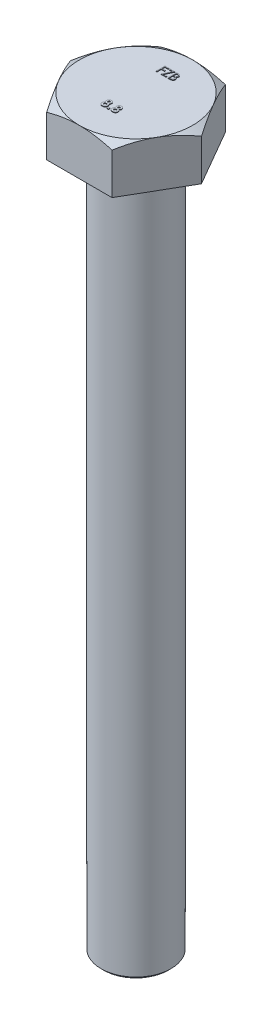
from build123d import *

# Parameters (mm, degrees)
BOSS_EXTRUDE1_DEPTH = 5.3
SKETCH4_R           = 4
BOSS_EXTRUDE3_DEPTH = 80
CHAMFER2_SIZE       = 0.3
BOSS_EXTRUDE5_DEPTH = 0.05


with BuildPart() as part:
    # Sketch2 → Boss-Extrude1 (new body)
    with BuildSketch(Plane(origin=(0, 0, 0), x_dir=(1, 0, 0), z_dir=(0, 1, 0))):
        Polygon((7.505553499, 0), (3.75277675, 6.5), (-3.75277675, 6.5), (-7.505553499, 0), (-3.75277675, -6.5), (3.75277675, -6.5), align=None)
    extrude(amount=-BOSS_EXTRUDE1_DEPTH)

    # Sketch4 → Boss-Extrude3 (add)
    with BuildSketch(Plane.XZ.offset(5.3)):
        Circle(SKETCH4_R)
    extrude(amount=BOSS_EXTRUDE3_DEPTH)

    # Chamfer2
    chamfer2_edges = [part.edges().sort_by_distance(p)[0] for p in [
        (-4, -85.3, 0),
    ]]
    chamfer(chamfer2_edges, length=CHAMFER2_SIZE)

    # Sketch6 → Cut-Revolve4 (revolve, cut)
    with BuildSketch(Plane.XY):
        Polygon((-6.5, 0), (-22.516660498, -9.24722325), (-22.516660498, 3.75277675), (-6.5, 3.75277675), align=None)
    revolve(axis=Axis((0, 0, 0), (0, 1, 0)), mode=Mode.SUBTRACT)

    # Sketch11 → Boss-Extrude5 (add)
    # profile 1 of 6: a face of its own
    with BuildSketch(Plane(origin=(0, 0, 0), x_dir=(1, 0, 0), z_dir=(0, 1, 0))):
        with BuildLine():
            add(Edge.make_bspline(
                [(-0.374198718, -2.711538462), (-0.363712458, -2.719031177), (-0.342955854, -2.733862332), (-0.315543972, -2.760432901), (-0.291932785, -2.790072678), (-0.272370236, -2.822599859), (-0.256697312, -2.857214919), (-0.245477876, -2.893547862), (-0.238351419, -2.931278225), (-0.237572997, -2.956966108), (-0.237179487, -2.969951923)],
                knots=[0, 0, 0, 0, 1.013736912, 2.006600758, 2.994453809, 3.989973287, 4.987781207, 5.978959008, 6.978317308, 8, 8, 8, 8], degree=3))
            add(Edge.make_bspline(
                [(-0.237179487, -2.969951923), (-0.237654227, -2.984013276), (-0.238595813, -3.011902163), (-0.246920691, -3.052801213), (-0.260285947, -3.092093405), (-0.278552179, -3.129345052), (-0.301454674, -3.163398515), (-0.328149662, -3.193545535), (-0.358670794, -3.21899877), (-0.387086833, -3.236268625), (-0.41154551, -3.247740664), (-0.431283448, -3.255082538), (-0.452125413, -3.261546031), (-0.47422013, -3.266709934), (-0.497563582, -3.270741207), (-0.522122455, -3.273403452), (-0.547912915, -3.275338742), (-0.565500918, -3.275538565), (-0.574519231, -3.275641026)],
                knots=[0, 0, 0, 0, 1.313679292, 2.605514271, 3.884962679, 5.186178731, 6.472827995, 7.711026938, 8.938935107, 10.174644318, 10.808706728, 11.462743532, 12.142127587, 12.847854939, 13.582806024, 14.355735269, 15.156897313, 16, 16, 16, 16], degree=3))
            add(Edge.make_bspline(
                [(-0.574519231, -3.275641026), (-0.584136366, -3.275510573), (-0.602916736, -3.275255826), (-0.630331892, -3.273715487), (-0.656192483, -3.270875699), (-0.680552756, -3.267137339), (-0.703389274, -3.262190405), (-0.724702714, -3.255917963), (-0.744544538, -3.248776091), (-0.768831974, -3.237901977), (-0.796588108, -3.220919719), (-0.82658747, -3.196049692), (-0.852919235, -3.166428713), (-0.87581221, -3.132888238), (-0.893857316, -3.095634609), (-0.907276195, -3.055837095), (-0.915223014, -3.013603543), (-0.916179722, -2.984675636), (-0.916666667, -2.969951923)],
                knots=[0, 0, 0, 0, 0.886964665, 1.7320671, 2.531131818, 3.285397207, 4.004107883, 4.684213108, 5.332925796, 5.947568694, 7.135706876, 8.320776993, 9.52873045, 10.778999824, 12.05415135, 13.333578234, 14.642845846, 16, 16, 16, 16], degree=3))
            add(Edge.make_bspline(
                [(-0.916666667, -2.969951923), (-0.916221681, -2.957107906), (-0.915347229, -2.931867856), (-0.909083416, -2.894883201), (-0.898342879, -2.859817372), (-0.883605191, -2.826426255), (-0.864601193, -2.794706134), (-0.841218505, -2.764890408), (-0.813753597, -2.736710096), (-0.792926445, -2.720068182), (-0.782251603, -2.711538462)],
                knots=[0, 0, 0, 0, 1.01821053, 2.000906977, 2.963938143, 3.919209931, 4.888045165, 5.887808425, 6.917407893, 8, 8, 8, 8], degree=3))
            add(Edge.make_bspline(
                [(-0.782251603, -2.711538462), (-0.788869438, -2.703905756), (-0.801897964, -2.688879258), (-0.818757004, -2.664695307), (-0.832960036, -2.639761628), (-0.845019086, -2.614280571), (-0.853933443, -2.587813416), (-0.860674752, -2.56077628), (-0.86448763, -2.532893718), (-0.865083594, -2.514100043), (-0.865384615, -2.504607372)],
                knots=[0, 0, 0, 0, 1.061529281, 2.089831458, 3.092927091, 4.075998741, 5.048384512, 6.024008542, 7.00192825, 8, 8, 8, 8], degree=3))
            add(Edge.make_bspline(
                [(-0.865384615, -2.504607372), (-0.864985507, -2.491757094), (-0.864198082, -2.466403991), (-0.857223904, -2.429331768), (-0.845645074, -2.394105767), (-0.829893061, -2.360829126), (-0.809890453, -2.330227071), (-0.786123025, -2.30278387), (-0.758256652, -2.279504754), (-0.727327611, -2.259530246), (-0.69318087, -2.243642707), (-0.656140411, -2.232525797), (-0.616653501, -2.225488207), (-0.589440302, -2.224741111), (-0.575520833, -2.224358974)],
                knots=[0, 0, 0, 0, 1.022455555, 2.017265428, 2.990720743, 3.968117071, 4.939886797, 5.893155559, 6.847550415, 7.820889576, 8.817530429, 9.83499769, 10.892607882, 12, 12, 12, 12], degree=3))
            add(Edge.make_bspline(
                [(-0.575520833, -2.224358974), (-0.561801841, -2.224741737), (-0.535052679, -2.225488044), (-0.496259699, -2.232479002), (-0.460019692, -2.243843543), (-0.426632334, -2.260066539), (-0.396023159, -2.280079546), (-0.368630396, -2.304169219), (-0.34493755, -2.332295938), (-0.324768908, -2.363689658), (-0.3086976, -2.397511843), (-0.296816138, -2.432981426), (-0.28994376, -2.469819612), (-0.288957588, -2.494831002), (-0.288461538, -2.507411859)],
                knots=[0, 0, 0, 0, 1.094655142, 2.134348324, 3.136019022, 4.118575226, 5.088726318, 6.048298823, 7.020513804, 8.015920439, 9.020015034, 10.003048569, 10.995523219, 12, 12, 12, 12], degree=3))
            add(Edge.make_bspline(
                [(-0.288461538, -2.507411859), (-0.288700497, -2.516303328), (-0.289169437, -2.533752172), (-0.292636679, -2.559459244), (-0.298475089, -2.584125214), (-0.306615154, -2.608346156), (-0.317932624, -2.632780291), (-0.333247791, -2.657895818), (-0.351876682, -2.684736295), (-0.36650688, -2.702302838), (-0.374198718, -2.711538462)],
                knots=[0, 0, 0, 0, 0.940746401, 1.846144481, 2.739104268, 3.619506754, 4.545839139, 5.581956076, 6.728711598, 8, 8, 8, 8], degree=3))
        make_face()
        with BuildLine():
            add(Edge.make_bspline(
                [(-0.579927885, -2.403846154), (-0.587317747, -2.404202414), (-0.601692661, -2.404895418), (-0.62220398, -2.411150545), (-0.640644326, -2.421381251), (-0.65659276, -2.435460716), (-0.669671307, -2.452544038), (-0.679283321, -2.472184807), (-0.684983359, -2.494140635), (-0.685586818, -2.509514522), (-0.685897436, -2.517427885)],
                knots=[0, 0, 0, 0, 1.018099191, 1.980427864, 2.929421084, 3.909248076, 4.895556904, 5.880788387, 6.909183412, 8, 8, 8, 8], degree=3))
            add(Edge.make_bspline(
                [(-0.685897436, -2.517427885), (-0.685513728, -2.525408829), (-0.684764503, -2.540992393), (-0.678872683, -2.563370063), (-0.668829915, -2.583650597), (-0.655041261, -2.601410399), (-0.638285814, -2.615916092), (-0.61952485, -2.626994733), (-0.598550305, -2.633319241), (-0.58397501, -2.634176867), (-0.576522436, -2.634615385)],
                knots=[0, 0, 0, 0, 1.07118507, 2.091592095, 3.082435519, 4.092579768, 5.090825648, 6.043203473, 6.999459622, 8, 8, 8, 8], degree=3))
            add(Edge.make_bspline(
                [(-0.576522436, -2.634615385), (-0.568928967, -2.634275609), (-0.554135464, -2.633613662), (-0.53310855, -2.62712505), (-0.514165987, -2.616747837), (-0.49794448, -2.602076754), (-0.484508089, -2.58431052), (-0.474722677, -2.563675567), (-0.469090546, -2.540559598), (-0.468338637, -2.524403658), (-0.467948718, -2.516025641)],
                knots=[0, 0, 0, 0, 1.008803858, 1.965339183, 2.900766489, 3.864508618, 4.855158575, 5.849593072, 6.884859315, 8, 8, 8, 8], degree=3))
            add(Edge.make_bspline(
                [(-0.467948718, -2.516025641), (-0.4683485, -2.508117509), (-0.469121666, -2.492823461), (-0.474665556, -2.470866209), (-0.484847187, -2.451531985), (-0.498224537, -2.434554747), (-0.514996149, -2.420863661), (-0.534466762, -2.410795154), (-0.556493002, -2.404955322), (-0.571947096, -2.404223883), (-0.579927885, -2.403846154)],
                knots=[0, 0, 0, 0, 1.065910571, 2.061433587, 3.023559535, 3.990682701, 4.956464619, 5.918590567, 6.925120432, 8, 8, 8, 8], degree=3))
        make_face(mode=Mode.SUBTRACT)
        with BuildLine():
            add(Edge.make_bspline(
                [(-0.57411859, -2.814102564), (-0.579734326, -2.814195822), (-0.59080287, -2.814379631), (-0.607074541, -2.816499233), (-0.622688881, -2.819657963), (-0.637626519, -2.824015342), (-0.65181199, -2.829955546), (-0.665365541, -2.837116572), (-0.678240362, -2.845570809), (-0.690245486, -2.855164769), (-0.701095312, -2.865695055), (-0.710875443, -2.876677802), (-0.71886932, -2.888396943), (-0.725526313, -2.900462931), (-0.730875245, -2.912971382), (-0.734411293, -2.926128285), (-0.736688013, -2.939758426), (-0.737014699, -2.949042725), (-0.737179487, -2.953725962)],
                knots=[0, 0, 0, 0, 1.129580664, 2.226389355, 3.296443603, 4.333934503, 5.352185725, 6.386189251, 7.41493955, 8.447544828, 9.47401038, 10.455044306, 11.4018853, 12.322125673, 13.225630306, 14.132028716, 15.057747923, 16, 16, 16, 16], degree=3))
            add(Edge.make_bspline(
                [(-0.737179487, -2.953725962), (-0.737100946, -2.958610114), (-0.73694517, -2.968297227), (-0.734592383, -2.982436351), (-0.731204786, -2.996072564), (-0.726446798, -3.009078225), (-0.720083893, -3.02144576), (-0.712486469, -3.03329541), (-0.703389606, -3.044544083), (-0.693039964, -3.055131466), (-0.681453585, -3.064683176), (-0.668966009, -3.073098399), (-0.655742166, -3.08051769), (-0.641385087, -3.085861357), (-0.626426471, -3.090752351), (-0.610465573, -3.093719599), (-0.593676721, -3.095902983), (-0.582206127, -3.096068792), (-0.576322115, -3.096153846)],
                knots=[0, 0, 0, 0, 0.973817353, 1.931446211, 2.852767904, 3.776304432, 4.688323523, 5.623710549, 6.581246645, 7.570897993, 8.57436511, 9.572506873, 10.574556662, 11.591826551, 12.624694332, 13.712108235, 14.826391851, 16, 16, 16, 16], degree=3))
            add(Edge.make_bspline(
                [(-0.576322115, -3.096153846), (-0.570374255, -3.096046034), (-0.558783758, -3.095835943), (-0.541840782, -3.093979132), (-0.525815734, -3.091032913), (-0.510727755, -3.086819133), (-0.496519789, -3.081421114), (-0.483382424, -3.074550504), (-0.471015712, -3.06676419), (-0.459817059, -3.057667448), (-0.449591863, -3.047753897), (-0.440781422, -3.036889488), (-0.433290001, -3.025423582), (-0.427247353, -3.013232289), (-0.422371479, -3.000373157), (-0.419026936, -2.986717966), (-0.416951527, -2.972420171), (-0.416762639, -2.962680868), (-0.416666667, -2.957732372)],
                knots=[0, 0, 0, 0, 1.200705402, 2.339794563, 3.437264955, 4.487414319, 5.499029866, 6.500076882, 7.476298407, 8.444948224, 9.407950986, 10.347155707, 11.263432813, 12.167927724, 13.089546445, 14.03463663, 15.00140776, 16, 16, 16, 16], degree=3))
            add(Edge.make_bspline(
                [(-0.416666667, -2.957732372), (-0.416849918, -2.952719181), (-0.417208111, -2.942920132), (-0.419168088, -2.92844953), (-0.422844807, -2.914731173), (-0.427655029, -2.901446899), (-0.434053728, -2.888871602), (-0.441997575, -2.877031823), (-0.451039623, -2.865634276), (-0.461607778, -2.85518634), (-0.473162413, -2.845633212), (-0.485460481, -2.837122424), (-0.498464101, -2.829914572), (-0.512208843, -2.824022511), (-0.526744927, -2.819655695), (-0.541961442, -2.816499344), (-0.557833428, -2.814379157), (-0.568636207, -2.814195679), (-0.57411859, -2.814102564)],
                knots=[0, 0, 0, 0, 1.011708178, 1.977538892, 2.938094892, 3.871441737, 4.823268678, 5.775953079, 6.743660653, 7.753304209, 8.767430709, 9.76505158, 10.765940967, 11.761741361, 12.775867861, 13.822051386, 14.89469657, 16, 16, 16, 16], degree=3))
        make_face(mode=Mode.SUBTRACT)
    # profile 2 of 6: a face of its own
    with BuildSketch(Plane(origin=(0, 0, 0), x_dir=(1, 0, 0), z_dir=(0, 1, 0))):
        with BuildLine():
            add(Edge.make_bspline(
                [(0, -3.044871795), (0.007245685, -3.045269058), (0.021511186, -3.046051202), (0.042122891, -3.051888254), (0.060725073, -3.062375351), (0.07735791, -3.076053951), (0.091422217, -3.092511134), (0.101587581, -3.111278538), (0.107917808, -3.131810823), (0.108616669, -3.146121206), (0.108974359, -3.153445513)],
                knots=[0, 0, 0, 0, 1.016957001, 2.002212695, 2.9757545, 3.99499976, 5.013036768, 5.994806404, 6.97370641, 8, 8, 8, 8], degree=3))
            add(Edge.make_bspline(
                [(0.108974359, -3.153445513), (0.108619013, -3.160770996), (0.107924729, -3.175083677), (0.101543776, -3.195655971), (0.091437408, -3.214577626), (0.077356781, -3.231211158), (0.060793956, -3.245147544), (0.042080121, -3.255537935), (0.021550451, -3.261706109), (0.007252596, -3.262445471), (0, -3.262820513)],
                knots=[0, 0, 0, 0, 1.023218912, 1.999186227, 2.986238111, 4.008388923, 5.030539734, 6.0011649, 6.986089706, 8, 8, 8, 8], degree=3))
            add(Edge.make_bspline(
                [(0, -3.262820513), (-0.007254314, -3.262448521), (-0.021555558, -3.261715171), (-0.04211714, -3.255485943), (-0.060969134, -3.245216915), (-0.077536121, -3.231194253), (-0.091679654, -3.214636527), (-0.101498689, -3.19559627), (-0.107939078, -3.175091433), (-0.10862387, -3.160773622), (-0.108974359, -3.153445513)],
                knots=[0, 0, 0, 0, 1.013427518, 1.99788335, 2.976245624, 3.997909735, 5.019573847, 6.001765691, 6.977268297, 8, 8, 8, 8], degree=3))
            add(Edge.make_bspline(
                [(-0.108974359, -3.153445513), (-0.108621558, -3.146118534), (-0.107932248, -3.131802932), (-0.101542369, -3.111338927), (-0.091663917, -3.092451913), (-0.077537301, -3.076070891), (-0.060899897, -3.062306522), (-0.042160149, -3.051939534), (-0.021516312, -3.046042073), (-0.007247411, -3.045265983), (0, -3.044871795)],
                knots=[0, 0, 0, 0, 1.025808215, 2.00424526, 2.981110158, 3.998665696, 5.017428914, 5.998734231, 6.983523959, 8, 8, 8, 8], degree=3))
        make_face()
    # profile 3 of 6: a face of its own
    with BuildSketch(Plane(origin=(0, 0, 0), x_dir=(1, 0, 0), z_dir=(0, 1, 0))):
        with BuildLine():
            add(Edge.make_bspline(
                [(0.779647436, -2.711538462), (0.790133695, -2.719031177), (0.8108903, -2.733862332), (0.838302182, -2.760432901), (0.861913369, -2.790072678), (0.881475918, -2.822599859), (0.897148842, -2.857214919), (0.908368278, -2.893547862), (0.915494735, -2.931278225), (0.916273157, -2.956966108), (0.916666667, -2.969951923)],
                knots=[0, 0, 0, 0, 1.013736912, 2.006600758, 2.994453809, 3.989973287, 4.987781207, 5.978959008, 6.978317308, 8, 8, 8, 8], degree=3))
            add(Edge.make_bspline(
                [(0.916666667, -2.969951923), (0.916191927, -2.984013276), (0.915250341, -3.011902163), (0.906925463, -3.052801213), (0.893560206, -3.092093405), (0.875293975, -3.129345052), (0.85239148, -3.163398515), (0.825696492, -3.193545535), (0.795175359, -3.21899877), (0.766759321, -3.236268625), (0.742300644, -3.247740664), (0.722562706, -3.255082538), (0.701720741, -3.261546031), (0.679626024, -3.266709934), (0.656282572, -3.270741207), (0.631723699, -3.273403452), (0.605933239, -3.275338742), (0.588345235, -3.275538565), (0.579326923, -3.275641026)],
                knots=[0, 0, 0, 0, 1.313679292, 2.605514271, 3.884962679, 5.186178731, 6.472827995, 7.711026938, 8.938935107, 10.174644318, 10.808706728, 11.462743532, 12.142127587, 12.847854939, 13.582806024, 14.355735269, 15.156897313, 16, 16, 16, 16], degree=3))
            add(Edge.make_bspline(
                [(0.579326923, -3.275641026), (0.569709788, -3.275510573), (0.550929418, -3.275255826), (0.523514262, -3.273715487), (0.497653671, -3.270875699), (0.473293398, -3.267137339), (0.45045688, -3.262190405), (0.42914344, -3.255917963), (0.409301616, -3.248776091), (0.38501418, -3.237901977), (0.357258046, -3.220919719), (0.327258684, -3.196049692), (0.300926919, -3.166428713), (0.278033944, -3.132888238), (0.259988838, -3.095634609), (0.246569959, -3.055837095), (0.23862314, -3.013603543), (0.237666432, -2.984675636), (0.237179487, -2.969951923)],
                knots=[0, 0, 0, 0, 0.886964665, 1.7320671, 2.531131818, 3.285397207, 4.004107883, 4.684213108, 5.332925796, 5.947568694, 7.135706876, 8.320776993, 9.52873045, 10.778999824, 12.05415135, 13.333578234, 14.642845846, 16, 16, 16, 16], degree=3))
            add(Edge.make_bspline(
                [(0.237179487, -2.969951923), (0.237624473, -2.957107906), (0.238498925, -2.931867856), (0.244762738, -2.894883201), (0.255503275, -2.859817372), (0.270240963, -2.826426255), (0.289244961, -2.794706134), (0.312627649, -2.764890408), (0.340092557, -2.736710096), (0.360919709, -2.720068182), (0.371594551, -2.711538462)],
                knots=[0, 0, 0, 0, 1.01821053, 2.000906977, 2.963938143, 3.919209931, 4.888045165, 5.887808425, 6.917407893, 8, 8, 8, 8], degree=3))
            add(Edge.make_bspline(
                [(0.371594551, -2.711538462), (0.364976715, -2.703905756), (0.35194819, -2.688879258), (0.33508915, -2.664695307), (0.320886118, -2.639761628), (0.308827068, -2.614280571), (0.299912711, -2.587813416), (0.293171402, -2.56077628), (0.289358524, -2.532893718), (0.28876256, -2.514100043), (0.288461538, -2.504607372)],
                knots=[0, 0, 0, 0, 1.061529281, 2.089831458, 3.092927091, 4.075998741, 5.048384512, 6.024008542, 7.00192825, 8, 8, 8, 8], degree=3))
            add(Edge.make_bspline(
                [(0.288461538, -2.504607372), (0.288860647, -2.491757094), (0.289648072, -2.466403991), (0.29662225, -2.429331768), (0.30820108, -2.394105767), (0.323953093, -2.360829126), (0.343955701, -2.330227071), (0.367723129, -2.30278387), (0.395589502, -2.279504754), (0.426518543, -2.259530246), (0.460665284, -2.243642707), (0.497705743, -2.232525797), (0.537192653, -2.225488207), (0.564405852, -2.224741111), (0.578325321, -2.224358974)],
                knots=[0, 0, 0, 0, 1.022455555, 2.017265428, 2.990720743, 3.968117071, 4.939886797, 5.893155559, 6.847550415, 7.820889576, 8.817530429, 9.83499769, 10.892607882, 12, 12, 12, 12], degree=3))
            add(Edge.make_bspline(
                [(0.578325321, -2.224358974), (0.592044313, -2.224741737), (0.618793475, -2.225488044), (0.657586454, -2.232479002), (0.693826462, -2.243843543), (0.72721382, -2.260066539), (0.757822995, -2.280079546), (0.785215758, -2.304169219), (0.808908603, -2.332295938), (0.829077246, -2.363689658), (0.845148554, -2.397511843), (0.857030016, -2.432981426), (0.863902394, -2.469819612), (0.864888566, -2.494831002), (0.865384615, -2.507411859)],
                knots=[0, 0, 0, 0, 1.094655142, 2.134348324, 3.136019022, 4.118575226, 5.088726318, 6.048298823, 7.020513804, 8.015920439, 9.020015034, 10.003048569, 10.995523219, 12, 12, 12, 12], degree=3))
            add(Edge.make_bspline(
                [(0.865384615, -2.507411859), (0.865145656, -2.516303328), (0.864676717, -2.533752172), (0.861209475, -2.559459244), (0.855371065, -2.584125214), (0.847231, -2.608346156), (0.83591353, -2.632780291), (0.820598363, -2.657895818), (0.801969472, -2.684736295), (0.787339274, -2.702302838), (0.779647436, -2.711538462)],
                knots=[0, 0, 0, 0, 0.940746401, 1.846144481, 2.739104268, 3.619506754, 4.545839139, 5.581956076, 6.728711598, 8, 8, 8, 8], degree=3))
        make_face()
        with BuildLine():
            add(Edge.make_bspline(
                [(0.573918269, -2.403846154), (0.566528407, -2.404202414), (0.552153493, -2.404895418), (0.531642174, -2.411150545), (0.513201828, -2.421381251), (0.497253394, -2.435460716), (0.484174847, -2.452544038), (0.474562833, -2.472184807), (0.468862795, -2.494140635), (0.468259335, -2.509514522), (0.467948718, -2.517427885)],
                knots=[0, 0, 0, 0, 1.018099191, 1.980427864, 2.929421084, 3.909248076, 4.895556904, 5.880788387, 6.909183412, 8, 8, 8, 8], degree=3))
            add(Edge.make_bspline(
                [(0.467948718, -2.517427885), (0.468332425, -2.525408829), (0.469081651, -2.540992393), (0.47497347, -2.563370063), (0.485016239, -2.583650597), (0.498804893, -2.601410399), (0.51556034, -2.615916092), (0.534321304, -2.626994733), (0.555295848, -2.633319241), (0.569871144, -2.634176867), (0.577323718, -2.634615385)],
                knots=[0, 0, 0, 0, 1.07118507, 2.091592095, 3.082435519, 4.092579768, 5.090825648, 6.043203473, 6.999459622, 8, 8, 8, 8], degree=3))
            add(Edge.make_bspline(
                [(0.577323718, -2.634615385), (0.584917187, -2.634275609), (0.599710689, -2.633613662), (0.620737604, -2.62712505), (0.639680167, -2.616747837), (0.655901674, -2.602076754), (0.669338064, -2.58431052), (0.679123477, -2.563675567), (0.684755608, -2.540559598), (0.685507517, -2.524403658), (0.685897436, -2.516025641)],
                knots=[0, 0, 0, 0, 1.008803858, 1.965339183, 2.900766489, 3.864508618, 4.855158575, 5.849593072, 6.884859315, 8, 8, 8, 8], degree=3))
            add(Edge.make_bspline(
                [(0.685897436, -2.516025641), (0.685497653, -2.508117509), (0.684724488, -2.492823461), (0.679180598, -2.470866209), (0.668998967, -2.451531985), (0.655621617, -2.434554747), (0.638850005, -2.420863661), (0.619379392, -2.410795154), (0.597353151, -2.404955322), (0.581899058, -2.404223883), (0.573918269, -2.403846154)],
                knots=[0, 0, 0, 0, 1.065910571, 2.061433587, 3.023559535, 3.990682701, 4.956464619, 5.918590567, 6.925120432, 8, 8, 8, 8], degree=3))
        make_face(mode=Mode.SUBTRACT)
        with BuildLine():
            add(Edge.make_bspline(
                [(0.579727564, -2.814102564), (0.574111828, -2.814195822), (0.563043283, -2.814379631), (0.546771613, -2.816499233), (0.531157273, -2.819657963), (0.516219635, -2.824015342), (0.502034164, -2.829955546), (0.488480613, -2.837116572), (0.475605792, -2.845570809), (0.463600668, -2.855164769), (0.452750842, -2.865695055), (0.442970711, -2.876677802), (0.434976834, -2.888396943), (0.428319841, -2.900462931), (0.422970909, -2.912971382), (0.419434861, -2.926128285), (0.417158141, -2.939758426), (0.416831455, -2.949042725), (0.416666667, -2.953725962)],
                knots=[0, 0, 0, 0, 1.129580664, 2.226389355, 3.296443603, 4.333934503, 5.352185725, 6.386189251, 7.41493955, 8.447544828, 9.47401038, 10.455044306, 11.4018853, 12.322125673, 13.225630306, 14.132028716, 15.057747923, 16, 16, 16, 16], degree=3))
            add(Edge.make_bspline(
                [(0.416666667, -2.953725962), (0.416745208, -2.958610114), (0.416900984, -2.968297227), (0.419253771, -2.982436351), (0.422641368, -2.996072564), (0.427399356, -3.009078225), (0.433762261, -3.02144576), (0.441359685, -3.03329541), (0.450456548, -3.044544083), (0.46080619, -3.055131466), (0.472392568, -3.064683176), (0.484880145, -3.073098399), (0.498103988, -3.08051769), (0.512461067, -3.085861357), (0.527419683, -3.090752351), (0.543380581, -3.093719599), (0.560169433, -3.095902983), (0.571640027, -3.096068792), (0.577524038, -3.096153846)],
                knots=[0, 0, 0, 0, 0.973817353, 1.931446211, 2.852767904, 3.776304432, 4.688323523, 5.623710549, 6.581246645, 7.570897993, 8.57436511, 9.572506873, 10.574556662, 11.591826551, 12.624694332, 13.712108235, 14.826391851, 16, 16, 16, 16], degree=3))
            add(Edge.make_bspline(
                [(0.577524038, -3.096153846), (0.583471899, -3.096046034), (0.595062396, -3.095835943), (0.612005372, -3.093979132), (0.62803042, -3.091032913), (0.643118399, -3.086819133), (0.657326365, -3.081421114), (0.67046373, -3.074550504), (0.682830442, -3.06676419), (0.694029095, -3.057667448), (0.704254291, -3.047753897), (0.713064732, -3.036889488), (0.720556153, -3.025423582), (0.726598801, -3.013232289), (0.731474674, -3.000373157), (0.734819218, -2.986717966), (0.736894627, -2.972420171), (0.737083514, -2.962680868), (0.737179487, -2.957732372)],
                knots=[0, 0, 0, 0, 1.200705402, 2.339794563, 3.437264955, 4.487414319, 5.499029866, 6.500076882, 7.476298407, 8.444948224, 9.407950986, 10.347155707, 11.263432813, 12.167927724, 13.089546445, 14.03463663, 15.00140776, 16, 16, 16, 16], degree=3))
            add(Edge.make_bspline(
                [(0.737179487, -2.957732372), (0.736996236, -2.952719181), (0.736638043, -2.942920132), (0.734678065, -2.92844953), (0.731001347, -2.914731173), (0.726191125, -2.901446899), (0.719792426, -2.888871602), (0.711848579, -2.877031823), (0.702806531, -2.865634276), (0.692238375, -2.85518634), (0.680683741, -2.845633212), (0.668385673, -2.837122424), (0.655382053, -2.829914572), (0.641637311, -2.824022511), (0.627101227, -2.819655695), (0.611884712, -2.816499344), (0.596012726, -2.814379157), (0.585209947, -2.814195679), (0.579727564, -2.814102564)],
                knots=[0, 0, 0, 0, 1.011708178, 1.977538892, 2.938094892, 3.871441737, 4.823268678, 5.775953079, 6.743660653, 7.753304209, 8.767430709, 9.76505158, 10.765940967, 11.761741361, 12.775867861, 13.822051386, 14.89469657, 16, 16, 16, 16], degree=3))
        make_face(mode=Mode.SUBTRACT)
    # profile 4 of 6: a face of its own
    with BuildSketch(Plane(origin=(0, 0, 0), x_dir=(1, 0, 0), z_dir=(0, 1, 0))):
        Polygon((-0.935897436, 4.25), (-0.448717949, 4.25), (-0.448717949, 4.147435897), (-0.846153846, 4.147435897), (-0.846153846, 3.83974359), (-0.448717949, 3.83974359), (-0.448717949, 3.737179487), (-0.846153846, 3.737179487), (-0.846153846, 3.25), (-0.935897436, 3.25), align=None)
    # profile 5 of 6: a face of its own
    with BuildSketch(Plane(origin=(0, 0, 0), x_dir=(1, 0, 0), z_dir=(0, 1, 0))):
        Polygon((-0.320512821, 4.147435897), (-0.320512821, 4.25), (0.205128205, 4.25), (-0.214342949, 3.352564103), (0.192307692, 3.352564103), (0.192307692, 3.25), (-0.358974359, 3.25), (0.060496795, 4.147435897), align=None)
    # profile 6 of 6: a face of its own
    with BuildSketch(Plane(origin=(0, 0, 0), x_dir=(1, 0, 0), z_dir=(0, 1, 0))):
        with BuildLine():
            Line((0.397435897, 4.25), (0.592548077, 4.25))
            add(Edge.make_bspline(
                [(0.592548077, 4.25), (0.602099071, 4.249949786), (0.620611274, 4.249852458), (0.647531114, 4.248342992), (0.67274506, 4.2462848), (0.696260424, 4.243019059), (0.718066339, 4.239078552), (0.738228521, 4.234306604), (0.756682856, 4.228584715), (0.778715066, 4.219485777), (0.803835255, 4.205964872), (0.831034796, 4.185985282), (0.85429315, 4.161547435), (0.874346383, 4.133980962), (0.89028956, 4.103656456), (0.901823645, 4.071296688), (0.909125895, 4.037319047), (0.909876876, 4.013992425), (0.91025641, 4.002203526)],
                knots=[0, 0, 0, 0, 1.001505555, 1.941167018, 2.826882275, 3.653841531, 4.429895133, 5.150066043, 5.825578002, 6.45369114, 7.647487171, 8.808567382, 9.977351308, 11.170798116, 12.373658725, 13.556498008, 14.765093433, 16, 16, 16, 16], degree=3))
            add(Edge.make_bspline(
                [(0.91025641, 4.002203526), (0.909944062, 3.991159938), (0.909330269, 3.969458248), (0.903460909, 3.937717074), (0.894272146, 3.90750244), (0.881499218, 3.878924615), (0.864898648, 3.852629297), (0.845224842, 3.828404364), (0.821488613, 3.807275491), (0.80370483, 3.795463233), (0.794671474, 3.789463141)],
                knots=[0, 0, 0, 0, 1.044552857, 2.05264487, 3.044412934, 4.028983338, 5.005914585, 5.980388656, 6.974128949, 8, 8, 8, 8], degree=3))
            add(Edge.make_bspline(
                [(0.794671474, 3.789463141), (0.806031597, 3.785101713), (0.827766324, 3.77675722), (0.857676614, 3.76200423), (0.883446569, 3.745957913), (0.905274325, 3.728434527), (0.923942227, 3.709546296), (0.940243067, 3.689016263), (0.954152031, 3.666576618), (0.966070009, 3.642461322), (0.975369654, 3.616916617), (0.982334198, 3.590182109), (0.986324898, 3.562353665), (0.986892795, 3.543414985), (0.987179487, 3.533854167)],
                knots=[0, 0, 0, 0, 1.27268992, 2.434971085, 3.483601985, 4.442670788, 5.356604649, 6.2567628, 7.179492994, 8.113709626, 9.066344395, 10.018646069, 10.999752585, 12, 12, 12, 12], degree=3))
            add(Edge.make_bspline(
                [(0.987179487, 3.533854167), (0.986900388, 3.524092203), (0.986351253, 3.504885267), (0.982299833, 3.476669514), (0.975440088, 3.449705243), (0.965991189, 3.423818048), (0.953659099, 3.39905801), (0.938651109, 3.375397077), (0.920756377, 3.353072983), (0.900738414, 3.331837662), (0.878092087, 3.312744008), (0.853659014, 3.295739521), (0.827131494, 3.281754932), (0.79894521, 3.270007497), (0.768783977, 3.261034012), (0.736783232, 3.254756133), (0.702970575, 3.250526123), (0.679767789, 3.25017835), (0.66786859, 3.25)],
                knots=[0, 0, 0, 0, 0.978564426, 1.925352924, 2.850884081, 3.763762016, 4.682927383, 5.618979971, 6.567305752, 7.547517671, 8.540179244, 9.531824382, 10.526200242, 11.540722885, 12.589160233, 13.674978461, 14.80764778, 16, 16, 16, 16], degree=3))
            Line((0.66786859, 3.25), (0.397435897, 3.25))
            Line((0.397435897, 3.25), (0.397435897, 4.25))
        make_face()
        with BuildLine():
            Line((0.487179487, 4.147435897), (0.487179487, 3.826923077))
            Line((0.487179487, 3.826923077), (0.547475962, 3.826923077))
            add(Edge.make_bspline(
                [(0.547475962, 3.826923077), (0.556289903, 3.827037341), (0.573320234, 3.827258121), (0.597983062, 3.827890555), (0.620875924, 3.829661424), (0.641959305, 3.831431785), (0.661200003, 3.834310239), (0.678555392, 3.837736559), (0.694297849, 3.841360247), (0.712452005, 3.847522957), (0.733044275, 3.856630864), (0.754996591, 3.870765675), (0.774349297, 3.887601204), (0.79069135, 3.907027193), (0.804066056, 3.928417532), (0.813355689, 3.951430926), (0.819654913, 3.975493821), (0.820223922, 3.992013322), (0.820512821, 4.000400641)],
                knots=[0, 0, 0, 0, 1.156816544, 2.235205308, 3.236616184, 4.169592532, 5.011045266, 5.787822928, 6.49130361, 7.128639758, 8.301311294, 9.436451833, 10.541879658, 11.654887649, 12.756523258, 13.837046038, 14.901820046, 16, 16, 16, 16], degree=3))
            add(Edge.make_bspline(
                [(0.820512821, 4.000400641), (0.820362483, 4.005950861), (0.82006758, 4.016838225), (0.817652351, 4.032709469), (0.81354733, 4.047636255), (0.808274675, 4.061823144), (0.800906478, 4.07482653), (0.792231203, 4.087096014), (0.781749577, 4.098213762), (0.769818916, 4.108605048), (0.756102167, 4.11781777), (0.740607512, 4.125886559), (0.723125318, 4.132383924), (0.703950217, 4.138074253), (0.682787049, 4.142070909), (0.659880034, 4.145400448), (0.635041543, 4.147095517), (0.617857228, 4.147319907), (0.608974359, 4.147435897)],
                knots=[0, 0, 0, 0, 0.91205012, 1.789085906, 2.630437955, 3.453916878, 4.269457761, 5.079663411, 5.91843418, 6.774407191, 7.675494373, 8.627863946, 9.638891023, 10.736472738, 11.911756761, 13.175263542, 14.539845004, 16, 16, 16, 16], degree=3))
            Line((0.608974359, 4.147435897), (0.487179487, 4.147435897))
        make_face(mode=Mode.SUBTRACT)
        with BuildLine():
            Line((0.487179487, 3.724358974), (0.487179487, 3.352564103))
            Line((0.487179487, 3.352564103), (0.614983974, 3.352564103))
            add(Edge.make_bspline(
                [(0.614983974, 3.352564103), (0.624132239, 3.352673745), (0.641764313, 3.352885065), (0.667221807, 3.353574938), (0.69081698, 3.35514416), (0.712442161, 3.357614403), (0.732330862, 3.360293959), (0.750244491, 3.363897183), (0.766328261, 3.368025457), (0.784978063, 3.374406649), (0.805979066, 3.384319926), (0.828610739, 3.399266848), (0.848732515, 3.417073508), (0.865819732, 3.43768234), (0.879823443, 3.460091291), (0.890010716, 3.483847105), (0.896293818, 3.508557256), (0.897054438, 3.525404888), (0.897435897, 3.533854167)],
                knots=[0, 0, 0, 0, 1.160039823, 2.235823828, 3.228722157, 4.157150951, 4.99529583, 5.772374946, 6.472645482, 7.099169577, 8.269452708, 9.405989375, 10.527446681, 11.663510218, 12.788923519, 13.866172445, 14.929861265, 16, 16, 16, 16], degree=3))
            add(Edge.make_bspline(
                [(0.897435897, 3.533854167), (0.89735701, 3.539137978), (0.897200509, 3.549620373), (0.894840333, 3.565024893), (0.891407799, 3.579946571), (0.886970247, 3.594425925), (0.880507542, 3.608201176), (0.872962815, 3.621544764), (0.8641167, 3.63447433), (0.850332652, 3.650820688), (0.830283514, 3.66965412), (0.801795864, 3.688093406), (0.769403779, 3.702964208), (0.745910209, 3.709278345), (0.733774038, 3.712540064)],
                knots=[0, 0, 0, 0, 0.723448775, 1.435228256, 2.130040452, 2.821711965, 3.505591119, 4.210454504, 4.921174351, 5.648778258, 7.137944449, 8.670945889, 10.280296675, 12, 12, 12, 12], degree=3))
            add(Edge.make_bspline(
                [(0.733774038, 3.712540064), (0.728908583, 3.713527231), (0.71835927, 3.715667612), (0.701157105, 3.717926956), (0.681518285, 3.71993983), (0.659397463, 3.721428733), (0.634766651, 3.722967745), (0.607573246, 3.723566265), (0.577928299, 3.72428034), (0.557359049, 3.724332092), (0.546674679, 3.724358974)],
                knots=[0, 0, 0, 0, 0.634451884, 1.375622551, 2.216452059, 3.157844607, 4.20941857, 5.370758133, 6.634282058, 8, 8, 8, 8], degree=3))
            Line((0.546674679, 3.724358974), (0.487179487, 3.724358974))
        make_face(mode=Mode.SUBTRACT)
    extrude(amount=BOSS_EXTRUDE5_DEPTH)


solid = part.part
